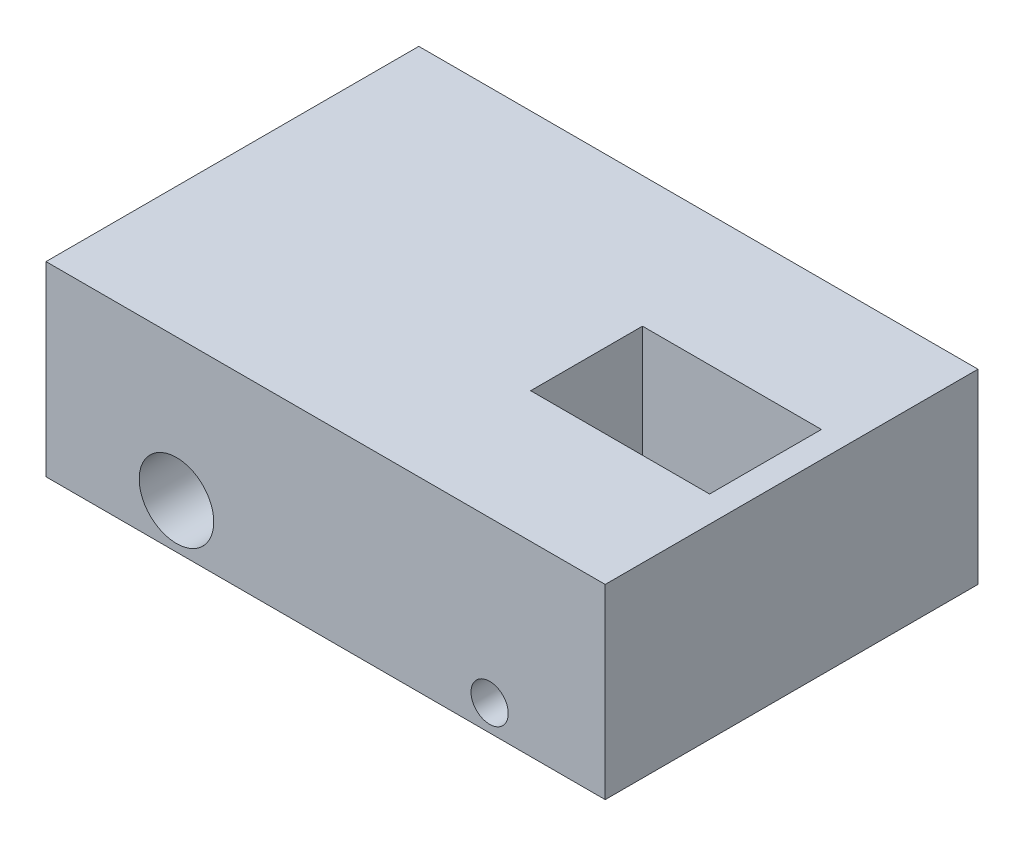
from build123d import *

# Parameters (mm, degrees)
SKETCH1_W               = 150
SKETCH1_H               = 100
BOSS_EXTRUDE1_DEPTH     = 50
SKETCH3_R               = 10
CUT_EXTRUDE1_DEPTH      = 100
SKETCH4_W               = 48
SKETCH4_H               = 30
CUT_EXTRUDE2_DEPTH      = 100
CUT_EXTRUDE3_DEPTH      = 112.130553854
CUT_EXTRUDE3_DEPTH_BACK = 112.130553854
SKETCH5_R               = 5


with BuildPart() as part:
    # Sketch1 → Boss-Extrude1 (new body)
    with BuildSketch(Plane(origin=(0, 0, 0), x_dir=(1, 0, 0), z_dir=(0, 1, 0))):
        Rectangle(SKETCH1_W, SKETCH1_H)
    extrude(amount=BOSS_EXTRUDE1_DEPTH)

    # Sketch3 → Cut-Extrude1 (cut)
    with BuildSketch(Plane.XY.offset(50)):
        with Locations((-40, 12)):
            Circle(SKETCH3_R)
    extrude(amount=-CUT_EXTRUDE1_DEPTH, mode=Mode.SUBTRACT)

    # Sketch4 → Cut-Extrude2 (cut)
    with BuildSketch(Plane.XZ):
        with Locations((44, 0)):
            Rectangle(SKETCH4_W, SKETCH4_H)
    extrude(amount=-CUT_EXTRUDE2_DEPTH, mode=Mode.SUBTRACT)

    # Sketch5 → Cut-Extrude3 (cut, two sides: drawn at the far end of the back side and taken through both)
    with BuildSketch(Plane(origin=(0, 0, 15), x_dir=(-1, 0, 0), z_dir=(0, 0, -1)).offset(-CUT_EXTRUDE3_DEPTH_BACK)):
        with Locations((-44, 7)):
            Circle(SKETCH5_R)
    extrude(amount=CUT_EXTRUDE3_DEPTH + CUT_EXTRUDE3_DEPTH_BACK, mode=Mode.SUBTRACT)


solid = part.part
